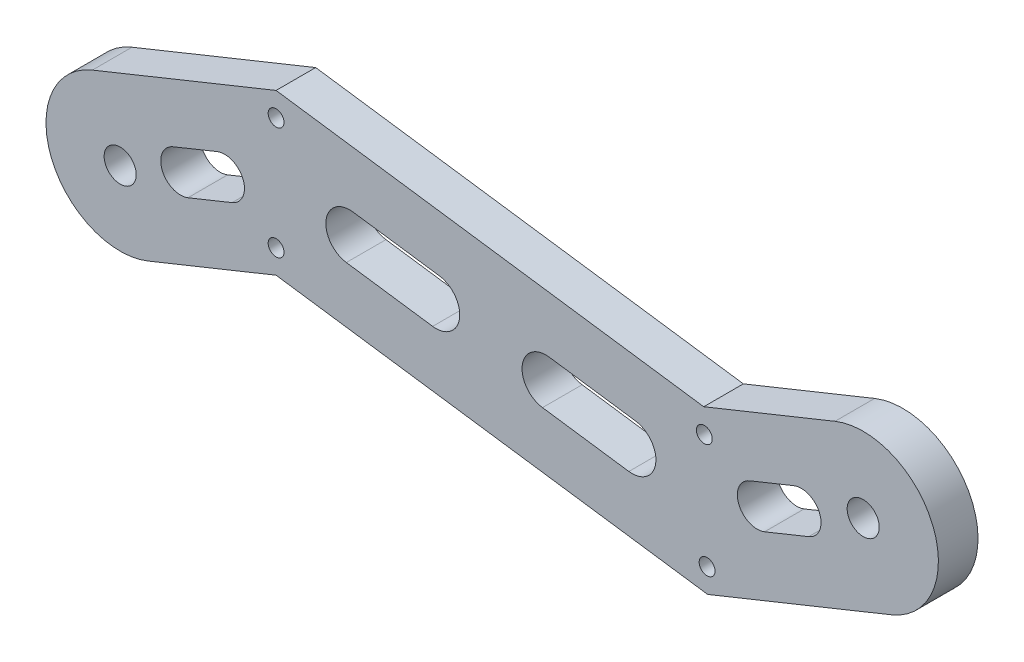
from build123d import *

# Parameters (mm, degrees)
SKETCH2_R           = 4.05
SKETCH2_R_2         = 2
BOSS_EXTRUDE1_DEPTH = 10


with BuildPart() as part:
    # Sketch2 → Boss-Extrude1 (new body)
    with BuildSketch(Plane.XY):
        with BuildLine():
            Line((-52.525602652, 39.073613719), (55.40832582, 23.904489319))
            Line((55.40832582, 23.904489319), (88.545070057, 37.292603029))
            ThreePointArc((88.545070057, 37.292603029), (113.24947567, 26.806204997), (102.763077638, 2.101799383))
            Line((102.763077638, 2.101799383), (56.40388491, -16.628530288))
            Line((56.40388491, -16.628530288), (-52.525602652, -1.319489182))
            Line((-52.525602652, -1.319489182), (-84.855091861, -14.38145069))
            ThreePointArc((-84.855091861, -14.38145069), (-109.23231099, -4.033935081), (-98.88479538, 20.343284048))
            Line((-98.88479538, 20.343284048), (-52.525602652, 39.073613719))
        make_face()
        with Locations((-91.869943621, 2.980916679)):
            Circle(SKETCH2_R, mode=Mode.SUBTRACT)
        with Locations((95.654073847, 19.697201206)):
            Circle(SKETCH2_R, mode=Mode.SUBTRACT)
        with Locations((-52.525602652, 33.073613719)):
            Circle(SKETCH2_R_2, mode=Mode.SUBTRACT)
        with Locations((55.555695905, 17.904489319)):
            Circle(SKETCH2_R_2, mode=Mode.SUBTRACT)
        with Locations((-52.525602652, 4.680510818)):
            Circle(SKETCH2_R_2, mode=Mode.SUBTRACT)
        with Locations((56.256514825, -10.628530288)):
            Circle(SKETCH2_R_2, mode=Mode.SUBTRACT)
        with BuildLine():
            Line((-33.124360513, 22.209360939), (-11.338463, 19.147552718))
            ThreePointArc((-11.338463, 19.147552718), (-6.231893194, 12.3709057), (-13.008540212, 7.264335893))
            Line((-13.008540212, 7.264335893), (-34.794437724, 10.326144114))
            ThreePointArc((-34.794437724, 10.326144114), (-39.901007531, 17.102791132), (-33.124360513, 22.209360939))
        make_face(mode=Mode.SUBTRACT)
        with BuildLine():
            Line((-78.505415838, 13.773210112), (-67.379209583, 18.268489233))
            ThreePointArc((-67.379209583, 18.268489233), (-60.870257343, 15.505602928), (-63.633143649, 8.996650688))
            Line((-63.633143649, 8.996650688), (-74.759349904, 4.501371567))
            ThreePointArc((-74.759349904, 4.501371567), (-81.268302144, 7.264257873), (-78.505415838, 13.773210112))
        make_face(mode=Mode.SUBTRACT)
        with BuildLine():
            Line((67.013646361, 13.518391096), (78.139852616, 18.013670217))
            ThreePointArc((78.139852616, 18.013670217), (84.648804856, 15.250783911), (81.88591855, 8.741831672))
            Line((81.88591855, 8.741831672), (70.759712296, 4.246552551))
            ThreePointArc((70.759712296, 4.246552551), (64.250760056, 7.009438856), (67.013646361, 13.518391096))
        make_face(mode=Mode.SUBTRACT)
        with BuildLine():
            Line((16.389042924, 15.250705891), (38.174940437, 12.18889767))
            ThreePointArc((38.174940437, 12.18889767), (43.281510244, 5.412250652), (36.504863225, 0.305680845))
            Line((36.504863225, 0.305680845), (14.718965713, 3.367489066))
            ThreePointArc((14.718965713, 3.367489066), (9.612395906, 10.144136084), (16.389042924, 15.250705891))
        make_face(mode=Mode.SUBTRACT)
    extrude(amount=BOSS_EXTRUDE1_DEPTH)


solid = part.part
